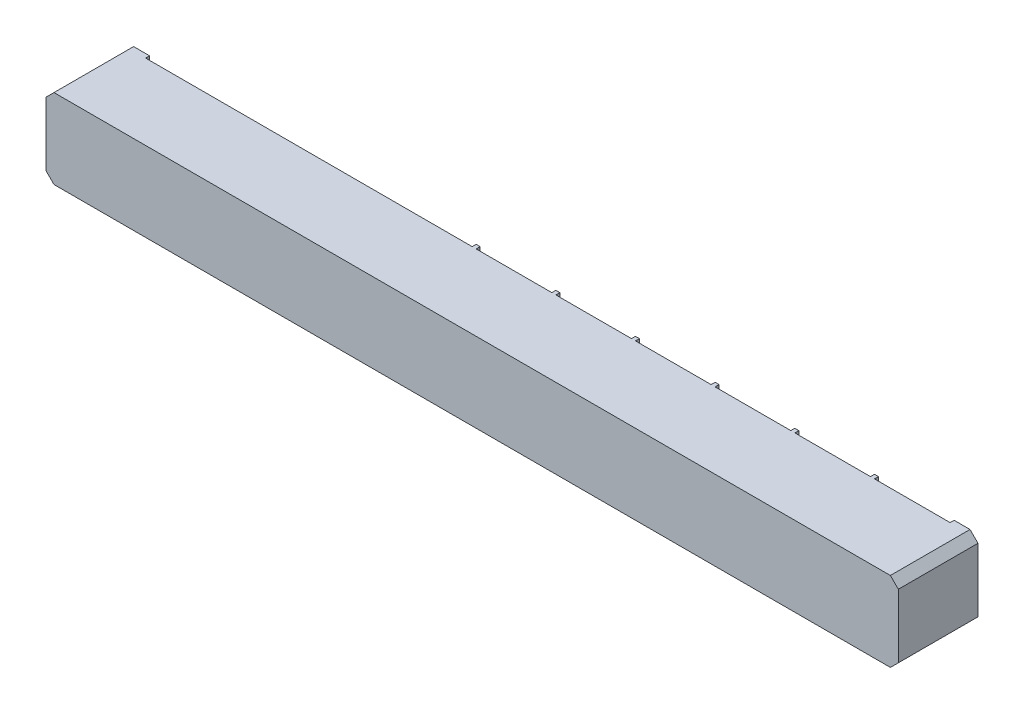
from build123d import *

# Parameters (mm, degrees)
CROQUIS1_W              = 100
CROQUIS1_H              = 100
SALIENTE_EXTRUIR2_DEPTH = 100
CROQUIS2_W              = 410
CROQUIS2_H              = 100
CROQUIS2_W_2            = 95
CORTAR_EXTRUIR2_DEPTH   = 5
CROQUIS3_R              = 15
CROQUIS3_R_2            = 35
SALIENTE_EXTRUIR3_DEPTH = 50


with BuildPart() as part:
    # Croquis1 → Saliente-Extruir2 (new body)
    with BuildSketch(Plane.XY):
        Polygon((793.691747165, 62.128712871), (793.691747165, -37.871287129), (893.691747165, -37.871287129), (923.691747165, -37.871287129), (933.691747165, -27.871287129), (933.691747165, 52.128712871), (923.691747165, 62.128712871), (893.691747165, 62.128712871), align=None)
        with Locations((743.691747165, 12.128712871)):
            Rectangle(CROQUIS1_W, CROQUIS1_H)
        with Locations((643.691747165, 12.128712871)):
            Rectangle(CROQUIS1_W, CROQUIS1_H)
        with Locations((543.691747165, 12.128712871)):
            Rectangle(CROQUIS1_W, CROQUIS1_H)
        with Locations((443.691747165, 12.128712871)):
            Rectangle(CROQUIS1_W, CROQUIS1_H)
        with Locations((343.691747165, 12.128712871)):
            Rectangle(CROQUIS1_W, CROQUIS1_H)
        Polygon((-126.308252835, -37.871287129), (-106.308252835, -37.871287129), (293.691747165, -37.871287129), (293.691747165, 62.128712871), (-106.308252835, 62.128712871), (-126.308252835, 62.128712871), (-136.308252835, 52.128712871), (-136.308252835, -27.871287129), align=None)
    extrude(amount=SALIENTE_EXTRUIR2_DEPTH)

    # Croquis2 → Cortar-Extruir2 (cut)
    with BuildSketch(Plane.XY):
        with Locations((98.691747165, 12.128712871)):
            Rectangle(CROQUIS2_W, CROQUIS2_H)
        with Locations((856.191747165, 12.128712871)):
            Rectangle(CROQUIS2_W_2, CROQUIS2_H)
        with Locations((756.191747165, 12.128712871)):
            Rectangle(CROQUIS2_W_2, CROQUIS2_H)
        with Locations((656.191747165, 12.128712871)):
            Rectangle(CROQUIS2_W_2, CROQUIS2_H)
        with Locations((556.191747165, 12.128712871)):
            Rectangle(CROQUIS2_W_2, CROQUIS2_H)
        with Locations((456.191747165, 12.128712871)):
            Rectangle(CROQUIS2_W_2, CROQUIS2_H)
        with Locations((356.191747165, 12.128712871)):
            Rectangle(CROQUIS2_W_2, CROQUIS2_H)
    extrude(amount=CORTAR_EXTRUIR2_DEPTH, mode=Mode.SUBTRACT)

    # Croquis3 → Saliente-Extruir3 (add)
    with BuildSketch(Plane(origin=(0, 0, 0), x_dir=(1, 0, 0), z_dir=(0, 1, 0))):
        with Locations(Location((856.191747165, -52.5, 0), (0, 0, 270))):
            Circle(CROQUIS3_R)
        with Locations(Location((756.191747165, -52.5, 0), (0, 0, 270))):
            Circle(CROQUIS3_R)
        with Locations(Location((661.191747165, -52.5, 0), (0, 0, 270))):
            Circle(CROQUIS3_R)
        with Locations(Location((556.191747165, -52.5, 0), (0, 0, 270))):
            Circle(CROQUIS3_R)
        with Locations(Location((461.191747165, -52.5, 0), (0, 0, 270))):
            Circle(CROQUIS3_R)
        with Locations(Location((356.191747165, -52.5, 0), (0, 0, 270))):
            Circle(CROQUIS3_R)
        with Locations(Location((98.691747165, -52.5, 0), (0, 0, 270))):
            Circle(CROQUIS3_R_2)
    extrude(amount=-SALIENTE_EXTRUIR3_DEPTH)


solid = part.part
